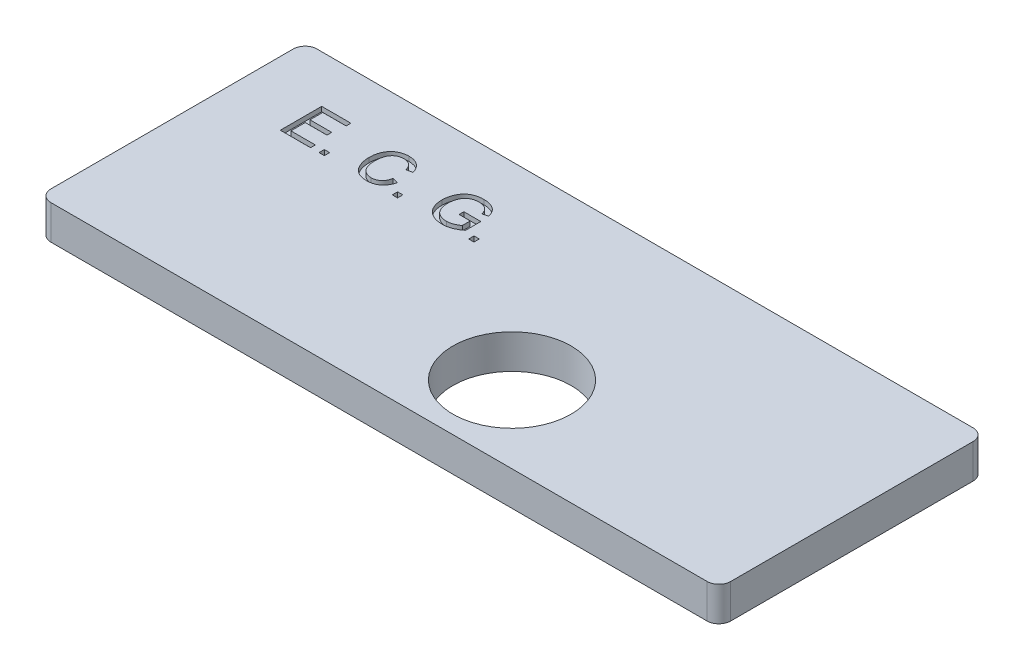
from build123d import *

# Parameters (mm, degrees)
BOSS_EXTRUDE1_DEPTH = 2.9
SKETCH2_R           = 5
CUT_EXTRUDE1_DEPTH  = 10
SKETCH3_W           = 0.448717949
SKETCH3_H           = 0.448717949
CUT_EXTRUDE2_DEPTH  = 0.5


with BuildPart() as part:
    # Sketch1 → Boss-Extrude1 (new body)
    with BuildSketch(Plane(origin=(0, 0, 0), x_dir=(1, 0, 0), z_dir=(0, 1, 0))):
        with BuildLine():
            Line((1, 0), (56.5, 0))
            ThreePointArc((56.5, 0), (57.207106781, 0.292893219), (57.5, 1))
            Line((57.5, 1), (57.5, 21.5))
            ThreePointArc((57.5, 21.5), (57.207106781, 22.207106781), (56.5, 22.5))
            Line((56.5, 22.5), (1, 22.5))
            ThreePointArc((1, 22.5), (0.292893219, 22.207106781), (0, 21.5))
            Line((0, 21.5), (0, 1))
            ThreePointArc((0, 1), (0.292893219, 0.292893219), (1, 0))
        make_face()
    extrude(amount=BOSS_EXTRUDE1_DEPTH)

    # Sketch2 → Cut-Extrude1 (cut)
    with BuildSketch(Plane(origin=(0, 0, 0), x_dir=(1, 0, 0), z_dir=(0, 1, 0))):
        with Locations(Location((33.5, 6.5, 0), (0, 0, 90))):
            Circle(SKETCH2_R)
    extrude(amount=CUT_EXTRUDE1_DEPTH, mode=Mode.SUBTRACT)

    # Sketch3 → Cut-Extrude2 (cut)
    with BuildSketch(Plane(origin=(0, 3, 0), x_dir=(1, 0, 0), z_dir=(0, 1, 0))):
        Polygon((5.403846154, 15), (5.403846154, 18.5), (7.871794872, 18.5), (7.871794872, 18.096153846), (5.897435897, 18.096153846), (5.897435897, 17.019230769), (7.737179487, 17.019230769), (7.737179487, 16.615384615), (5.897435897, 16.615384615), (5.897435897, 15.403846154), (7.961538462, 15.403846154), (7.961538462, 15), align=None)
        with Locations((8.903846154, 15.224358975)):
            Rectangle(SKETCH3_W, SKETCH3_H)
        with BuildLine():
            Line((13.705128205, 16.235376603), (14.198717949, 16.120392628))
            add(Edge.make_bspline(
                [(14.198717949, 16.120392628), (14.186352148, 16.074129833), (14.162163106, 15.983634063), (14.114338433, 15.854124599), (14.060661103, 15.732585491), (13.99982866, 15.619336895), (13.9311753, 15.51502992), (13.856520058, 15.418324021), (13.772905946, 15.33124721), (13.683400865, 15.251789802), (13.587307921, 15.18170858), (13.485785666, 15.121192159), (13.379324835, 15.069704969), (13.267495148, 15.027365065), (13.150224105, 14.995500658), (13.028115535, 14.972276011), (12.900813379, 14.957970981), (12.814039865, 14.956087682), (12.769831731, 14.955128205)],
                knots=[0, 0, 0, 0, 1.145254194, 2.240259345, 3.299159039, 4.322497661, 5.312016644, 6.284080175, 7.241264552, 8.196044782, 9.144516039, 10.082428046, 11.020306713, 11.970622414, 12.939253955, 13.924100776, 14.94240044, 16, 16, 16, 16], degree=3))
            add(Edge.make_bspline(
                [(12.769831731, 14.955128205), (12.724473329, 14.955787181), (12.635733241, 14.957076415), (12.505734128, 14.967562703), (12.382092206, 14.985749538), (12.265038374, 15.011017542), (12.154178642, 15.042259858), (12.049972716, 15.08156546), (11.952603116, 15.128650743), (11.861257649, 15.182198879), (11.776324292, 15.243031973), (11.69587163, 15.309508305), (11.621852787, 15.383457894), (11.55241701, 15.463134724), (11.489076637, 15.549589841), (11.429501362, 15.641648716), (11.376599019, 15.740933423), (11.328409088, 15.845603222), (11.286111756, 15.95464472), (11.248693412, 16.065904046), (11.21810187, 16.179602897), (11.191764527, 16.294784517), (11.172631723, 16.41241808), (11.157440869, 16.531620974), (11.149088632, 16.653124015), (11.147989566, 16.734797473), (11.147435897, 16.775941506)],
                knots=[0, 0, 0, 0, 1.180702053, 2.309949215, 3.392367133, 4.431746864, 5.425408375, 6.388154007, 7.326956194, 8.237882283, 9.141054626, 10.043899035, 10.951650021, 11.86168169, 12.792564695, 13.739356664, 14.713891418, 15.718426911, 16.737522708, 17.757217648, 18.772674716, 19.801476837, 20.831699174, 21.873853055, 22.928926693, 24, 24, 24, 24], degree=3))
            add(Edge.make_bspline(
                [(11.147435897, 16.775941506), (11.14822776, 16.820358149), (11.14979228, 16.908114217), (11.158623973, 17.037600843), (11.17484459, 17.162571278), (11.19737031, 17.283107724), (11.225874357, 17.399307799), (11.261059408, 17.511228115), (11.302480373, 17.618725472), (11.350010974, 17.721918406), (11.403966996, 17.819655012), (11.462738072, 17.912074231), (11.527726119, 17.99765858), (11.597004336, 18.078043173), (11.672302995, 18.151889514), (11.753392166, 18.219364884), (11.839572247, 18.281084744), (11.930830657, 18.33647611), (12.025974545, 18.385079136), (12.123590716, 18.428370275), (12.224067431, 18.463853247), (12.326608084, 18.493355913), (12.431433434, 18.516842775), (12.538788418, 18.532548514), (12.648573837, 18.542783589), (12.722599741, 18.544170688), (12.760016026, 18.544871795)],
                knots=[0, 0, 0, 0, 1.185634383, 2.342514083, 3.462112933, 4.547331452, 5.613960142, 6.653690668, 7.676612054, 8.686959706, 9.683658101, 10.654407272, 11.607580201, 12.5494388, 13.484601218, 14.419076806, 15.362504069, 16.311442244, 17.265594461, 18.212500624, 19.159571152, 20.107257795, 21.059246075, 22.024387127, 23.001429356, 24, 24, 24, 24], degree=3))
            add(Edge.make_bspline(
                [(12.760016026, 18.544871795), (12.801879808, 18.544082683), (12.884167217, 18.542531606), (13.00490933, 18.529773692), (13.120548749, 18.508405584), (13.23158656, 18.480372647), (13.336868325, 18.44198972), (13.437537058, 18.396356832), (13.532591305, 18.341534444), (13.622770669, 18.279029176), (13.706607169, 18.208725752), (13.785274007, 18.132303702), (13.855563563, 18.047853033), (13.920259731, 17.957417601), (13.977326953, 17.859743375), (14.028864675, 17.75568197), (14.073185615, 17.644459808), (14.096899526, 17.566990496), (14.108974359, 17.527544071)],
                knots=[0, 0, 0, 0, 1.098391872, 2.158997981, 3.181470371, 4.182549255, 5.160268219, 6.118029851, 7.079534476, 8.035645336, 8.993622929, 9.94770573, 10.909620999, 11.872786677, 12.862530088, 13.874594564, 14.917769567, 16, 16, 16, 16], degree=3))
            Line((14.108974359, 17.527544071), (13.615384615, 17.421674679))
            add(Edge.make_bspline(
                [(13.615384615, 17.421674679), (13.605691283, 17.451947786), (13.586718433, 17.511201622), (13.553030282, 17.595648868), (13.516648201, 17.674043504), (13.476705541, 17.745852636), (13.433115737, 17.811093466), (13.386882546, 17.870558899), (13.336898267, 17.923139004), (13.284179623, 17.970046146), (13.227365263, 18.010006543), (13.167787163, 18.04541803), (13.104189118, 18.074715636), (13.037486035, 18.099495359), (12.967054445, 18.118355397), (12.893181156, 18.131624179), (12.815801262, 18.139303499), (12.76307121, 18.140443976), (12.736177885, 18.141025641)],
                knots=[0, 0, 0, 0, 1.235697765, 2.418642872, 3.532555292, 4.594392283, 5.610119701, 6.580908344, 7.519430642, 8.427315627, 9.319973334, 10.216139639, 11.118687699, 12.038725643, 12.980015607, 13.949697744, 14.954307006, 16, 16, 16, 16], degree=3))
            add(Edge.make_bspline(
                [(12.736177885, 18.141025641), (12.705301887, 18.140577661), (12.64457791, 18.139696616), (12.555367084, 18.130053681), (12.469693663, 18.115850579), (12.388196166, 18.094551805), (12.310428634, 18.067997774), (12.236852554, 18.034933306), (12.166842054, 17.996177871), (12.101178488, 17.951498738), (12.040413697, 17.901270794), (11.982898702, 17.848171999), (11.931394861, 17.789725945), (11.883938177, 17.727859831), (11.841910588, 17.661480438), (11.804078717, 17.591491933), (11.770683715, 17.517320706), (11.734280894, 17.412930321), (11.69716334, 17.27847792), (11.664963815, 17.113951759), (11.644453477, 16.9468335), (11.642170669, 16.834426714), (11.641025641, 16.778044872)],
                knots=[0, 0, 0, 0, 0.935256702, 1.839373932, 2.716087708, 3.564631604, 4.388828665, 5.203538865, 6.005592122, 6.810952829, 7.606223804, 8.392839071, 9.180346482, 9.963639178, 10.753404291, 11.558266631, 12.372976832, 13.215232055, 14.905983541, 16.594894834, 18.292041732, 20, 20, 20, 20], degree=3))
            add(Edge.make_bspline(
                [(11.641025641, 16.778044872), (11.64231707, 16.707154141), (11.64482256, 16.569619704), (11.669545585, 16.370309587), (11.707239226, 16.184406896), (11.752730021, 16.039365756), (11.798361859, 15.93238068), (11.835266597, 15.857457489), (11.877391883, 15.788127202), (11.923689907, 15.723996085), (11.974757038, 15.665251207), (12.029881806, 15.611580509), (12.089076524, 15.562467555), (12.153042596, 15.52021141), (12.219317886, 15.482691638), (12.287066054, 15.44932834), (12.356329756, 15.421111139), (12.427388439, 15.399191445), (12.499244252, 15.380249781), (12.572688611, 15.367876198), (12.647700572, 15.360892937), (12.69806925, 15.359619013), (12.723557692, 15.358974359)],
                knots=[0, 0, 0, 0, 2.10686522, 4.087509323, 5.961373225, 7.741398778, 8.594514555, 9.418024779, 10.222433421, 11.003575649, 11.767087398, 12.533660211, 13.289033706, 14.050297079, 14.809623433, 15.552362432, 16.294320901, 17.0305302, 17.761969017, 18.502233515, 19.242073914, 20, 20, 20, 20], degree=3))
            add(Edge.make_bspline(
                [(12.723557692, 15.358974359), (12.753974658, 15.359612267), (12.814058921, 15.36087236), (12.902150079, 15.371902028), (12.987068741, 15.388155687), (13.06778613, 15.413236724), (13.145387984, 15.443945514), (13.219238491, 15.481814824), (13.289105401, 15.527360551), (13.355810504, 15.579073445), (13.418123697, 15.637913882), (13.475230389, 15.703407815), (13.526461543, 15.77585382), (13.573965716, 15.854089245), (13.613877952, 15.940451271), (13.650846106, 16.032365826), (13.681650642, 16.131343607), (13.697189931, 16.200200788), (13.705128205, 16.235376603)],
                knots=[0, 0, 0, 0, 1.013374089, 2.001772144, 2.95501459, 3.891367103, 4.814208647, 5.733921849, 6.652182523, 7.590185968, 8.54346024, 9.504121027, 10.481158517, 11.497760682, 12.549996529, 13.647863555, 14.798406869, 16, 16, 16, 16], degree=3))
        make_face()
        with Locations((15.096153847, 15.224358975)):
            Rectangle(SKETCH3_W, SKETCH3_H)
        with BuildLine():
            Line((19.134615385, 16.391025641), (19.134615385, 16.794871795))
            Line((19.134615385, 16.794871795), (20.570512821, 16.794871795))
            Line((20.570512821, 16.794871795), (20.570512821, 15.49989984))
            add(Edge.make_bspline(
                [(20.570512821, 15.49989984), (20.513859392, 15.456750997), (20.402358416, 15.371828721), (20.227491869, 15.261078037), (20.049757213, 15.167148292), (19.869645643, 15.08960295), (19.686538092, 15.029753414), (19.501225094, 14.986914525), (19.313504844, 14.959780852), (19.187289716, 14.956680456), (19.124098558, 14.955128205)],
                knots=[0, 0, 0, 0, 1.08433114, 2.134098231, 3.14842993, 4.143565882, 5.117308249, 6.078377492, 7.037916032, 8, 8, 8, 8], degree=3))
            add(Edge.make_bspline(
                [(19.124098558, 14.955128205), (19.081773584, 14.95577793), (18.997693552, 14.957068632), (18.873208794, 14.968110648), (18.751630758, 14.984517514), (18.633190051, 15.008642925), (18.51746853, 15.039357221), (18.404689089, 15.077314596), (18.294804455, 15.121607961), (18.188427156, 15.172388346), (18.087156107, 15.230569649), (17.991269969, 15.294360865), (17.901978373, 15.364722995), (17.819143881, 15.441080516), (17.743065999, 15.523887709), (17.672617536, 15.612043998), (17.60968815, 15.707164801), (17.552888258, 15.807500448), (17.502733751, 15.912291666), (17.458942014, 16.020644192), (17.422743998, 16.132298091), (17.392554368, 16.246759415), (17.368545955, 16.363985025), (17.351776822, 16.484342317), (17.341905697, 16.607739239), (17.34046901, 16.691088079), (17.33974359, 16.733173077)],
                knots=[0, 0, 0, 0, 1.072770755, 2.131096365, 3.165876834, 4.181397123, 5.193125461, 6.199217581, 7.195986042, 8.195005739, 9.184865672, 10.154356418, 11.112044544, 12.063776475, 13.007136321, 13.960176652, 14.921449994, 15.895149614, 16.88092309, 17.86448639, 18.855604391, 19.854360534, 20.864074582, 21.88711945, 22.933151623, 24, 24, 24, 24], degree=3))
            add(Edge.make_bspline(
                [(17.33974359, 16.733173077), (17.340471005, 16.775024362), (17.341915625, 16.858139402), (17.35187107, 16.981993249), (17.368701645, 17.103678542), (17.391936928, 17.223264867), (17.4212598, 17.340648493), (17.457789726, 17.455852141), (17.501494696, 17.56877028), (17.550993508, 17.679164285), (17.606123099, 17.785454625), (17.669434123, 17.884244432), (17.735997631, 17.977841948), (17.811305302, 18.062178142), (17.890115835, 18.141607421), (17.976285374, 18.212301051), (18.067641967, 18.276387075), (18.164580732, 18.333176713), (18.266531441, 18.382737397), (18.372277498, 18.426385772), (18.482058901, 18.462605788), (18.595246418, 18.493163936), (18.712467233, 18.51586912), (18.833419202, 18.532948944), (18.958238991, 18.542704434), (19.042752226, 18.544143348), (19.085536859, 18.544871795)],
                knots=[0, 0, 0, 0, 1.059979929, 2.105079288, 3.144800512, 4.169876923, 5.189194625, 6.207600986, 7.228841866, 8.254191695, 9.270945245, 10.257936415, 11.22408152, 12.176290364, 13.118065146, 14.055588944, 14.994904974, 15.942096138, 16.897776019, 17.864011786, 18.837383209, 19.823806203, 20.831455606, 21.859450402, 22.916351634, 24, 24, 24, 24], degree=3))
            add(Edge.make_bspline(
                [(19.085536859, 18.544871795), (19.147300554, 18.543385872), (19.267978667, 18.540482575), (19.44465932, 18.517902208), (19.611757228, 18.479264053), (19.744180935, 18.434872958), (19.843641711, 18.391613204), (19.913945975, 18.356650603), (19.980030649, 18.318471925), (20.042656426, 18.278317862), (20.100424884, 18.233553501), (20.154095105, 18.186283753), (20.203808326, 18.135941862), (20.265012598, 18.06409431), (20.33502767, 17.96429096), (20.405278734, 17.82876378), (20.466810068, 17.67768767), (20.497264134, 17.569498089), (20.513020833, 17.513521635)],
                knots=[0, 0, 0, 0, 1.539867261, 3.008697525, 4.432261777, 5.810773619, 6.484177873, 7.135742803, 7.767512201, 8.386601754, 8.989234153, 9.587908519, 10.168964172, 10.7517707, 11.940093668, 13.199243526, 14.550910222, 16, 16, 16, 16], degree=3))
            Line((20.513020833, 17.513521635), (20.061498397, 17.399939904))
            add(Edge.make_bspline(
                [(20.061498397, 17.399939904), (20.048466326, 17.441476398), (20.023507004, 17.521028043), (19.979543907, 17.632213383), (19.928330601, 17.728221033), (19.873570959, 17.812729234), (19.808333183, 17.885426536), (19.732589556, 17.949841387), (19.644072127, 18.005783557), (19.544730097, 18.053681064), (19.436727862, 18.092793431), (19.321777466, 18.120665631), (19.201049291, 18.137999895), (19.118549266, 18.140002865), (19.076422276, 18.141025641)],
                knots=[0, 0, 0, 0, 1.164883671, 2.23101188, 3.193404931, 4.072828119, 4.918883984, 5.797350418, 6.725503451, 7.712871826, 8.743577122, 9.793233972, 10.87315899, 12, 12, 12, 12], degree=3))
            add(Edge.make_bspline(
                [(19.076422276, 18.141025641), (19.026591735, 18.139769494), (18.930113697, 18.137337441), (18.790303471, 18.119902827), (18.660923312, 18.090160713), (18.542406871, 18.047780708), (18.435251908, 17.995686744), (18.337925276, 17.936779994), (18.25207691, 17.869342151), (18.177380493, 17.794233415), (18.112419605, 17.713885276), (18.054492236, 17.630134155), (18.00411687, 17.54230435), (17.977210565, 17.480604733), (17.963741987, 17.449719551)],
                knots=[0, 0, 0, 0, 1.282088634, 2.482280855, 3.618640035, 4.691464057, 5.71354971, 6.679981643, 7.61357903, 8.515091979, 9.399860987, 10.268958177, 11.133486685, 12, 12, 12, 12], degree=3))
            add(Edge.make_bspline(
                [(17.963741987, 17.449719551), (17.943629508, 17.395397993), (17.903146586, 17.286058145), (17.863598762, 17.113735356), (17.838070109, 16.934931599), (17.834928094, 16.813192257), (17.833333333, 16.751402244)],
                knots=[0, 0, 0, 0, 0.971932623, 1.956331326, 2.96271565, 4, 4, 4, 4], degree=3))
            add(Edge.make_bspline(
                [(17.833333333, 16.751402244), (17.833575016, 16.713523386), (17.834048479, 16.639317489), (17.842534529, 16.530362298), (17.85363031, 16.425842932), (17.871638176, 16.326271954), (17.893047882, 16.231352598), (17.919603447, 16.141032947), (17.952063641, 16.055763813), (17.988319683, 15.974710203), (18.029802832, 15.898747668), (18.075998821, 15.827957107), (18.126736192, 15.76237628), (18.181841923, 15.701932842), (18.240498577, 15.645412636), (18.304543168, 15.594972524), (18.373255515, 15.549879919), (18.469656151, 15.49618011), (18.596763362, 15.441969578), (18.75432156, 15.393602961), (18.917159894, 15.364876794), (19.027232911, 15.36095284), (19.082732372, 15.358974359)],
                knots=[0, 0, 0, 0, 1.070760406, 2.097653971, 3.088708526, 4.041547766, 4.95691435, 5.839291284, 6.700934147, 7.534993757, 8.348268852, 9.145600082, 9.922850605, 10.690119832, 11.456705726, 12.223547942, 12.991528328, 13.778467112, 15.341275849, 16.888285822, 18.431055468, 20, 20, 20, 20], degree=3))
            add(Edge.make_bspline(
                [(19.082732372, 15.358974359), (19.131417525, 15.360576606), (19.228563441, 15.363773716), (19.37319347, 15.385959184), (19.515549746, 15.423630866), (19.653185792, 15.474491842), (19.781935306, 15.532748857), (19.895900691, 15.595171172), (19.994864251, 15.657458416), (20.050531127, 15.705152442), (20.076923077, 15.727764423)],
                knots=[0, 0, 0, 0, 1.08078364, 2.156585965, 3.240205791, 4.344938036, 5.41078367, 6.374425311, 7.229306744, 8, 8, 8, 8], degree=3))
            Line((20.076923077, 15.727764423), (20.076923077, 16.391025641))
            Line((20.076923077, 16.391025641), (19.134615385, 16.391025641))
        make_face()
        with Locations((21.557692308, 15.224358975)):
            Rectangle(SKETCH3_W, SKETCH3_H)
    extrude(amount=-CUT_EXTRUDE2_DEPTH, mode=Mode.SUBTRACT)


solid = part.part
